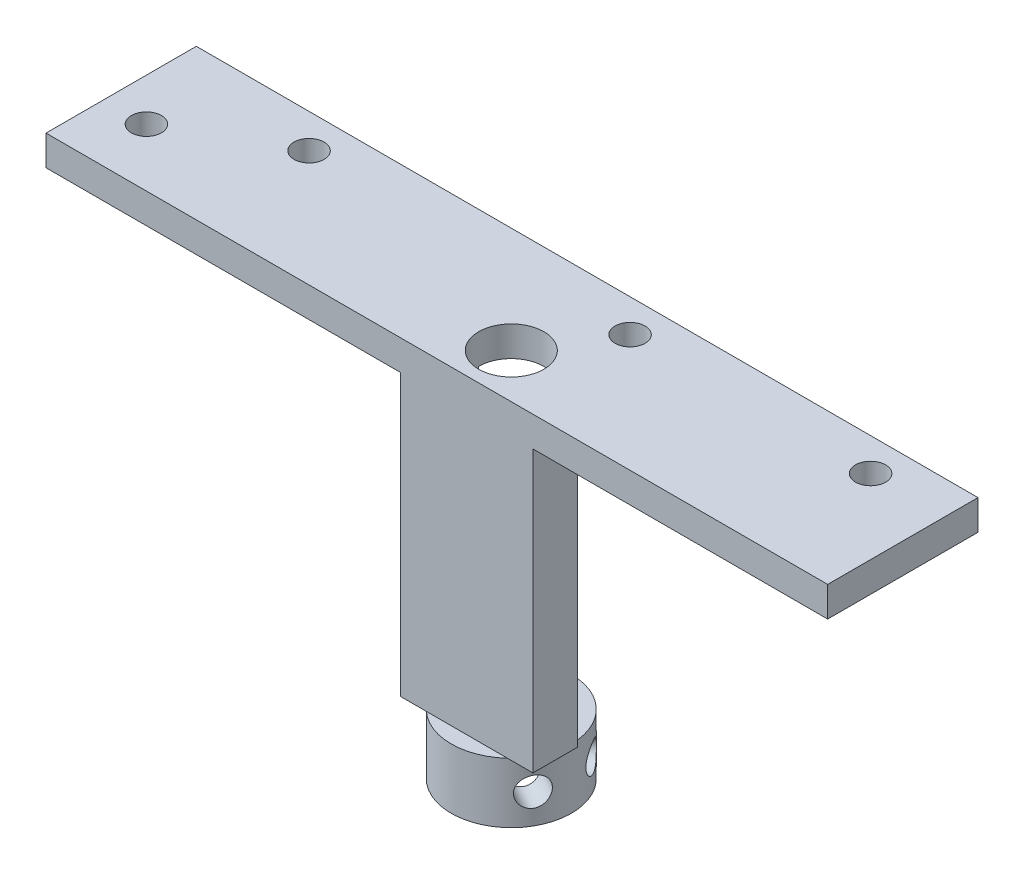
from build123d import *

# Parameters (mm, degrees)
SKETCH_1_W                = 78
SKETCH_1_H                = 15
EXTRUDE_1_DEPTH           = 3
SKETCH_3_R                = 1.5
CUT_EXTRUDE_1_DEPTH       = 3
SKETCH_4_R                = 6
EXTRUDE_2_DEPTH           = 18
SKETCH_5_R                = 4.5
CUT_EXTRUDE_2_DEPTH       = 21
F_2_0MM_2_D               = 3
F_2_0MM_2_DEPTH           = 4.5
F_2_0MM_2_TIP             = 1.5
F_2_0MM_2_ON_FACE_2_D     = 3
F_2_0MM_2_ON_FACE_2_DEPTH = 4.5
F_2_0MM_2_ON_FACE_2_TIP   = 1.5
SKETCH_10_W               = 6
SKETCH_10_H               = 10
CUT_EXTRUDE_3_DEPTH       = 7
SKETCH_13_W               = 19.835687411
SKETCH_13_H               = 21.610205193
CUT_EXTRUDE_4_DEPTH       = 20
SKETCH_14_W               = 11.523038103
SKETCH_14_H               = 10.49031299
EXTRUDE_3_DEPTH           = 3
SKETCH_18_W               = 78
SKETCH_18_H               = 8
EXTRUDE_4_DEPTH           = 3
SKETCH_19_W               = 36.767904102
SKETCH_19_H               = 2.5
EXTRUDE_5_DEPTH           = 12.5
SKETCH_23_R               = 1.65
CUT_EXTRUDE_6_DEPTH       = 12.5
SKETCH_25_W               = 4.236607592
SKETCH_25_H               = 5.36409187
EXTRUDE_7_DEPTH           = 2.5
SKETCH_26_R               = 1.6
CUT_EXTRUDE_7_DEPTH       = 2.5
SKETCH_27_W               = 21.346012392
SKETCH_27_H               = 6.594354882
EXTRUDE_8_DEPTH           = 2.5
SKETCH_28_W               = 36.767231154
SKETCH_28_H               = 5.91819544
EXTRUDE_9_DEPTH           = 2.5
SKETCH_29_W               = 27.660340415
SKETCH_29_H               = 3.5
CUT_EXTRUDE_9_DEPTH       = 2.5
SKETCH_30_W               = 78
SKETCH_30_H               = 8
CUT_EXTRUDE_10_DEPTH      = 100
SKETCH_31_W               = 60.820132647
SKETCH_31_H               = 3
EXTRUDE_10_DEPTH          = 49
SKETCH_32_W               = 48
SKETCH_32_H               = 3.2
CUT_EXTRUDE_11_DEPTH      = 49
SKETCH_33_W               = 15
SKETCH_33_H               = 49.05968874
CUT_EXTRUDE_12_DEPTH      = 100
SKETCH_34_R               = 4.25
EXTRUDE_11_DEPTH          = 49
SKETCH_35_R               = 6
EXTRUDE_12_DEPTH          = 6
SKETCH_36_W               = 8.5
SKETCH_36_H               = 40
CUT_EXTRUDE_13_DEPTH      = 11
SKETCH_37_R               = 3.25
CUT_EXTRUDE_16_DEPTH      = 100
SKETCH_39_W               = 8.456699936
SKETCH_39_H               = 16
CUT_EXTRUDE_17_DEPTH      = 1.25
F_3_0MM_1_D               = 2.85
F_3_0MM_1_DEPTH           = 4.143773618
F_3_0MM_1_TIP             = 0.856226382
F_3_0MM_2_D               = 2.85
F_3_0MM_2_DEPTH           = 4.143773618
F_3_0MM_2_TIP             = 0.856226382
F_3_0MM_3_D               = 2.85
F_3_0MM_3_DEPTH           = 4.143773618
F_3_0MM_3_TIP             = 0.856226382
SKETCH_46_W               = 13.227107738
SKETCH_46_H               = 4.428434999
EXTRUDE_13_DEPTH          = 46
CUT_EXTRUDE_18_DEPTH      = 55
EXTRUDE_START             = 15
EXTRUDE_14_DEPTH          = 15
SKETCH_50_R               = 1.5
CUT_EXTRUDE_19_DEPTH      = 15
SKETCH_51_R               = 1.5
CUT_EXTRUDE_20_DEPTH      = 15
SKETCH_52_R               = 1.5
CUT_EXTRUDE_21_DEPTH      = 15
SKETCH_53_R               = 1.5
CUT_EXTRUDE_22_DEPTH      = 15
SKETCH_54_W               = 78
SKETCH_54_H               = 15
CUT_EXTRUDE_23_DEPTH      = 15
F_3_0MM_4_D               = 2.85
F_3_0MM_4_DEPTH           = 4.143773618
F_3_0MM_4_TIP             = 0.856226382
F_3_0MM_5_D               = 2.85
F_3_0MM_5_DEPTH           = 4.143773618
F_3_0MM_5_TIP             = 0.856226382


with BuildPart() as part:
    # 草图1 → 凸台-拉伸1 (new body)
    with BuildSketch(Plane(origin=(0, 0, 0), x_dir=(1, 0, 0), z_dir=(0, 1, 0))):
        Rectangle(SKETCH_1_W, SKETCH_1_H)
    extrude(amount=EXTRUDE_1_DEPTH)

    # 草图3 → 切除-拉伸1 (cut)
    with BuildSketch(Plane(origin=(0, 3, 0), x_dir=(1, 0, 0), z_dir=(0, 1, 0))):
        with Locations(Location((-34.76, -1.72, 0), (0, 0, 270))):
            Circle(SKETCH_3_R)
        with Locations(Location((-24.35, 4.1, 0), (0, 0, 270))):
            Circle(SKETCH_3_R)
        with Locations(Location((31.56, 4.221692081, 0), (0, 0, 270))):
            Circle(SKETCH_3_R)
        with Locations(Location((7.56, 4.221692081, 0), (0, 0, 270))):
            Circle(SKETCH_3_R)
    extrude(amount=-CUT_EXTRUDE_1_DEPTH, mode=Mode.SUBTRACT)

    # 草图4 → 凸台-拉伸2 (add)
    with BuildSketch(Plane(origin=(0, 3, 0), x_dir=(1, 0, 0), z_dir=(0, 1, 0))):
        with Locations(Location((-3, -1.234165229, 0), (0, 0, 270))):
            Circle(SKETCH_4_R)
    extrude(amount=EXTRUDE_2_DEPTH)

    # 草图5 → 切除-拉伸2 (cut)
    with BuildSketch(Plane(origin=(0, 21, 0), x_dir=(1, 0, 0), z_dir=(0, 1, 0))):
        with Locations(Location((-3, -1.234165229, 0), (0, 0, 270))):
            Circle(SKETCH_5_R)
    extrude(amount=-CUT_EXTRUDE_2_DEPTH, mode=Mode.SUBTRACT)

    # Ø2.0mm 暗销孔2
    with Locations(Plane(origin=(-7.901331048, 17.342107422, 4.694938836), x_dir=(-0.576795601176, 0, -0.816888507977), z_dir=(-0.816888507977, 0, 0.576795601176))):
        with Locations((0, 0)):
            Hole(F_2_0MM_2_D / 2, depth=F_2_0MM_2_DEPTH)
            with Locations((0, 0, -(F_2_0MM_2_DEPTH + F_2_0MM_2_TIP / 2))):  # 90° drill point
                Cone(0, F_2_0MM_2_D / 2, F_2_0MM_2_TIP, mode=Mode.SUBTRACT)

    # Ø2.0mm 暗销孔2 on face 2
    with Locations(Plane(origin=(1.071764877, 17.164817099, 5.641061052), x_dir=(0.734483043181, 0, -0.678627039897), z_dir=(0.678627039897, 0, 0.734483043181))):
        with Locations((0, 0)):
            Hole(F_2_0MM_2_ON_FACE_2_D / 2, depth=F_2_0MM_2_ON_FACE_2_DEPTH)
            with Locations((0, 0, -(F_2_0MM_2_ON_FACE_2_DEPTH + F_2_0MM_2_ON_FACE_2_TIP / 2))):  # 90° drill point
                Cone(0, F_2_0MM_2_ON_FACE_2_D / 2, F_2_0MM_2_ON_FACE_2_TIP, mode=Mode.SUBTRACT)

    # 草图10 → 切除-拉伸3 (cut)
    with BuildSketch(Plane(origin=(0, 0, -7.5), x_dir=(-1, 0, 0), z_dir=(0, 0, -1))):
        with Locations((3, 8)):
            Rectangle(SKETCH_10_W, SKETCH_10_H)
    extrude(amount=-CUT_EXTRUDE_3_DEPTH, mode=Mode.SUBTRACT)

    # 草图13 → 切除-拉伸4 (cut)
    with BuildSketch(Plane(origin=(0, 0, -7.5), x_dir=(-1, 0, 0), z_dir=(0, 0, -1))):
        with Locations((3.314421038, 13.805102597)):
            Rectangle(SKETCH_13_W, SKETCH_13_H)
    extrude(amount=-CUT_EXTRUDE_4_DEPTH, mode=Mode.SUBTRACT)

    # 草图14 → 凸台-拉伸3 (add)
    with BuildSketch(Plane(origin=(0, 3, 0), x_dir=(1, 0, 0), z_dir=(0, 1, 0))):
        with Locations((-2.989467433, -1.263493391)):
            Rectangle(SKETCH_14_W, SKETCH_14_H)
    extrude(amount=-EXTRUDE_3_DEPTH)

    # 草图18 → 凸台-拉伸4 (add)
    with BuildSketch(Plane.XZ):
        with Locations((0, 11.5)):
            Rectangle(SKETCH_18_W, SKETCH_18_H)
    extrude(amount=-EXTRUDE_4_DEPTH)

    # 草图19 → 凸台-拉伸5 (add)
    with BuildSketch(Plane.XZ):
        with Locations((0.839237194, 14.25)):
            Rectangle(SKETCH_19_W, SKETCH_19_H)
    extrude(amount=EXTRUDE_5_DEPTH)

    # 草图23 → 切除-拉伸6 (cut)
    with BuildSketch(Plane(origin=(0, 0, 13), x_dir=(-1, 0, 0), z_dir=(0, 0, -1))):
        with Locations((-8.603189245, -6.05592298)):
            Circle(SKETCH_23_R)
        with Locations((2.596810755, -6.05592298)):
            Circle(SKETCH_23_R)
    extrude(amount=-CUT_EXTRUDE_6_DEPTH, mode=Mode.SUBTRACT)

    # 草图25 → 凸台-拉伸7 (add)
    with BuildSketch(Plane(origin=(0, 0, 13), x_dir=(-1, 0, 0), z_dir=(0, 0, -1))):
        with Locations((2.330668631, -6.426480946)):
            Rectangle(SKETCH_25_W, SKETCH_25_H)
    extrude(amount=-EXTRUDE_7_DEPTH)

    # 草图26 → 切除-拉伸7 (cut)
    with BuildSketch(Plane(origin=(0, 0, 13), x_dir=(-1, 0, 0), z_dir=(0, 0, -1))):
        with Locations((4.196810755, -6.05592298)):
            Circle(SKETCH_26_R)
    extrude(amount=-CUT_EXTRUDE_7_DEPTH, mode=Mode.SUBTRACT)

    # 草图27 → 凸台-拉伸8 (add)
    with BuildSketch(Plane(origin=(0, 0, 13), x_dir=(-1, 0, 0), z_dir=(0, 0, -1))):
        with Locations((-2.379316694, -6.691741876)):
            Rectangle(SKETCH_27_W, SKETCH_27_H)
    extrude(amount=-EXTRUDE_8_DEPTH)

    # 草图28 → 凸台-拉伸9 (add)
    with BuildSketch(Plane(origin=(0, 0, 13), x_dir=(-1, 0, 0), z_dir=(0, 0, -1))):
        with Locations((-0.839573668, -15.45909772)):
            Rectangle(SKETCH_28_W, SKETCH_28_H)
    extrude(amount=-EXTRUDE_9_DEPTH)

    # 草图29 → 切除-拉伸9 (cut)
    with BuildSketch(Plane(origin=(0, 0, 13), x_dir=(-1, 0, 0), z_dir=(0, 0, -1))):
        with Locations((-0.633763758, -13.394190827)):
            Rectangle(SKETCH_29_W, SKETCH_29_H)
    extrude(amount=-CUT_EXTRUDE_9_DEPTH, mode=Mode.SUBTRACT)

    # 草图30 → 切除-拉伸10 (cut)
    with BuildSketch(Plane(origin=(0, 3, 0), x_dir=(1, 0, 0), z_dir=(0, 1, 0))):
        with Locations((0, -11.5)):
            Rectangle(SKETCH_30_W, SKETCH_30_H)
    extrude(amount=-CUT_EXTRUDE_10_DEPTH, mode=Mode.SUBTRACT)

    # 草图31 → 凸台-拉伸10 (add)
    with BuildSketch(Plane.XZ):
        with Locations((0.65611444, 6)):
            Rectangle(SKETCH_31_W, SKETCH_31_H)
    extrude(amount=EXTRUDE_10_DEPTH)

    # 草图32 → 切除-拉伸11 (cut)
    with BuildSketch(Plane(origin=(0, 0, 4.5), x_dir=(-1, 0, 0), z_dir=(0, 0, -1))):
        with Locations((-0.175604554, -15.854114518)):
            Rectangle(SKETCH_32_W, SKETCH_32_H)
        with Locations((-0.205191163, -23.054114518)):
            Rectangle(SKETCH_32_W, SKETCH_32_H)
        with Locations((-0.173277927, -30.254114518)):
            Rectangle(SKETCH_32_W, SKETCH_32_H)
        with Locations((-0.15338956, -37.454114518)):
            Rectangle(SKETCH_32_W, SKETCH_32_H)
        with Locations((-0.189333293, -44.654114518)):
            Rectangle(SKETCH_32_W, SKETCH_32_H)
        with Locations((-0.276259634, -9.654114518)):
            Rectangle(SKETCH_32_W, SKETCH_32_H)
    extrude(amount=-CUT_EXTRUDE_11_DEPTH, mode=Mode.SUBTRACT)

    # 草图33 → 切除-拉伸12 (cut)
    with BuildSketch(Plane(origin=(31.066180764, 0, 0), x_dir=(0, 0, -1), z_dir=(1, 0, 0))):
        with Locations((0, -24.52984437)):
            Rectangle(SKETCH_33_W, SKETCH_33_H)
    extrude(amount=-CUT_EXTRUDE_12_DEPTH, mode=Mode.SUBTRACT)

    # 草图34 → 凸台-拉伸11 (add)
    with BuildSketch(Plane.XZ):
        with Locations(Location((3, 3.071565001, 0), (0, 0, 90))):
            Circle(SKETCH_34_R)
    extrude(amount=EXTRUDE_11_DEPTH)

    # 草图35 → 凸台-拉伸12 (add)
    with BuildSketch(Plane.XZ.offset(49)):
        with Locations(Location((3, 3.071565001, 0), (0, 0, 270))):
            Circle(SKETCH_35_R)
    extrude(amount=-EXTRUDE_12_DEPTH)

    # 草图36 → 切除-拉伸13 (cut)
    with BuildSketch(Plane(origin=(0, 0, -7.5), x_dir=(-1, 0, 0), z_dir=(0, 0, -1))):
        with Locations((-3, -20)):
            Rectangle(SKETCH_36_W, SKETCH_36_H)
    extrude(amount=-CUT_EXTRUDE_13_DEPTH, mode=Mode.SUBTRACT)

    # 草图37 → 切除-拉伸16 (cut)
    with BuildSketch(Plane.XZ.offset(49)):
        with Locations(Location((3, 3.071565001, 0), (0, 0, 270))):
            Circle(SKETCH_37_R)
    extrude(amount=-CUT_EXTRUDE_16_DEPTH, mode=Mode.SUBTRACT)

    # 草图39 → 切除-拉伸17 (cut)
    with BuildSketch(Plane(origin=(0, 0, 3.5), x_dir=(-1, 0, 0), z_dir=(0, 0, -1))):
        with Locations((-3, -32)):
            Rectangle(SKETCH_39_W, SKETCH_39_H)
    extrude(amount=-CUT_EXTRUDE_17_DEPTH, mode=Mode.SUBTRACT)

    # Ø3.0mm 暗销孔1
    with Locations(Plane(origin=(3.06916604, -45.926554475, -2.928036324), x_dir=(-0.999933554166, 0, -0.011527673319), z_dir=(0.011527673319, 0, -0.999933554166))):
        with Locations((0, 0)):
            Hole(F_3_0MM_1_D / 2, depth=F_3_0MM_1_DEPTH)
            with Locations((0, 0, -(F_3_0MM_1_DEPTH + F_3_0MM_1_TIP / 2))):  # 118° drill point
                Cone(0, F_3_0MM_1_D / 2, F_3_0MM_1_TIP, mode=Mode.SUBTRACT)

    # Ø3.0mm 暗销孔2
    with Locations(Plane(origin=(-2.19436254, -45.980907568, 6.074663036), x_dir=(-0.500516339146, 0, -0.865727089936), z_dir=(-0.865727089936, 0, 0.500516339146))):
        with Locations((0, 0)):
            Hole(F_3_0MM_2_D / 2, depth=F_3_0MM_2_DEPTH)
            with Locations((0, 0, -(F_3_0MM_2_DEPTH + F_3_0MM_2_TIP / 2))):  # 118° drill point
                Cone(0, F_3_0MM_2_D / 2, F_3_0MM_2_TIP, mode=Mode.SUBTRACT)

    # Ø3.0mm 暗销孔3
    with Locations(Plane(origin=(8.205806468, -46.039954185, 6.054781221), x_dir=(-0.497202703373, 0, 0.86763441135), z_dir=(0.86763441135, 0, 0.497202703373))):
        with Locations((0, 0)):
            Hole(F_3_0MM_3_D / 2, depth=F_3_0MM_3_DEPTH)
            with Locations((0, 0, -(F_3_0MM_3_DEPTH + F_3_0MM_3_TIP / 2))):  # 118° drill point
                Cone(0, F_3_0MM_3_D / 2, F_3_0MM_3_TIP, mode=Mode.SUBTRACT)

    # 草图46 → 凸台-拉伸13 (add)
    with BuildSketch(Plane(origin=(0, 3, 0), x_dir=(1, 0, 0), z_dir=(0, 1, 0))):
        with Locations((2.976074231, -5.285782501)):
            Rectangle(SKETCH_46_W, SKETCH_46_H)
    extrude(amount=-EXTRUDE_13_DEPTH)

    # 草图48 → 切除-拉伸18 (cut)
    with BuildSketch(Plane.XZ.offset(49)):
        with BuildLine():
            Line((-0.25, 3.071565001), (6.25, 3.071565001))
            ThreePointArc((6.25, 3.071565001), (3, 6.321565001), (-0.25, 3.071565001))
        make_face()
    extrude(amount=-CUT_EXTRUDE_18_DEPTH, mode=Mode.SUBTRACT)

    # 草图49 → 凸台-拉伸14 (add)
    with BuildSketch(Plane.XZ.offset(EXTRUDE_START)):
        with BuildLine():
            Line((-0.25, 3.071565001), (-3.637479638, 3.071565001))
            Line((-3.637479638, 3.071565001), (-3.637479638, 7.5))
            Line((-3.637479638, 7.5), (-39, 7.5))
            Line((-39, 7.5), (-39, -7.5))
            Line((-39, -7.5), (39, -7.5))
            Line((39, -7.5), (39, 7.5))
            Line((39, 7.5), (9.5896281, 7.5))
            Line((9.5896281, 7.5), (9.5896281, 3.071565001))
            Line((9.5896281, 3.071565001), (6.25, 3.071565001))
            ThreePointArc((6.25, 3.071565001), (3, -0.178434999), (-0.25, 3.071565001))
        make_face()
    extrude(amount=-EXTRUDE_14_DEPTH)

    # 草图50 → 切除-拉伸19 (cut)
    with BuildSketch(Plane(origin=(0, 0, 0), x_dir=(1, 0, 0), z_dir=(0, 1, 0))):
        with Locations(Location((-34.76, -1.72, 0), (0, 0, 270))):
            Circle(SKETCH_50_R)
    extrude(amount=-CUT_EXTRUDE_19_DEPTH, mode=Mode.SUBTRACT)

    # 草图51 → 切除-拉伸20 (cut)
    with BuildSketch(Plane(origin=(0, 0, 0), x_dir=(1, 0, 0), z_dir=(0, 1, 0))):
        with Locations(Location((-24.35, 4.1, 0), (0, 0, 270))):
            Circle(SKETCH_51_R)
    extrude(amount=-CUT_EXTRUDE_20_DEPTH, mode=Mode.SUBTRACT)

    # 草图52 → 切除-拉伸21 (cut)
    with BuildSketch(Plane(origin=(0, 0, 0), x_dir=(1, 0, 0), z_dir=(0, 1, 0))):
        with Locations(Location((7.56, 4.221692081, 0), (0, 0, 270))):
            Circle(SKETCH_52_R)
    extrude(amount=-CUT_EXTRUDE_21_DEPTH, mode=Mode.SUBTRACT)

    # 草图53 → 切除-拉伸22 (cut)
    with BuildSketch(Plane(origin=(0, 0, 0), x_dir=(1, 0, 0), z_dir=(0, 1, 0))):
        with Locations(Location((31.56, 4.221692081, 0), (0, 0, 270))):
            Circle(SKETCH_53_R)
    extrude(amount=-CUT_EXTRUDE_22_DEPTH, mode=Mode.SUBTRACT)

    # 草图54 → 切除-拉伸23 (cut)
    with BuildSketch(Plane(origin=(0, 3, 0), x_dir=(1, 0, 0), z_dir=(0, 1, 0))):
        Rectangle(SKETCH_54_W, SKETCH_54_H)
    extrude(amount=-CUT_EXTRUDE_23_DEPTH, mode=Mode.SUBTRACT)

    # Ø3.0mm 暗销孔4
    with Locations(Plane(origin=(-2.206820669, -45.974417651, 0.09011929), x_dir=(0.496907618427, 0, -0.867803444767), z_dir=(-0.867803444767, 0, -0.496907618427))):
        with Locations((0, 0)):
            Hole(F_3_0MM_4_D / 2, depth=F_3_0MM_4_DEPTH)
            with Locations((0, 0, -(F_3_0MM_4_DEPTH + F_3_0MM_4_TIP / 2))):  # 118° drill point
                Cone(0, F_3_0MM_4_D / 2, F_3_0MM_4_TIP, mode=Mode.SUBTRACT)

    # Ø3.0mm 暗销孔5
    with Locations(Plane(origin=(8.192046128, -46.012961975, 0.064463904), x_dir=(0.501183516141, 0, 0.865341021303), z_dir=(0.865341021303, 0, -0.501183516141))):
        with Locations((0, 0)):
            Hole(F_3_0MM_5_D / 2, depth=F_3_0MM_5_DEPTH)
            with Locations((0, 0, -(F_3_0MM_5_DEPTH + F_3_0MM_5_TIP / 2))):  # 118° drill point
                Cone(0, F_3_0MM_5_D / 2, F_3_0MM_5_TIP, mode=Mode.SUBTRACT)


solid = part.part
